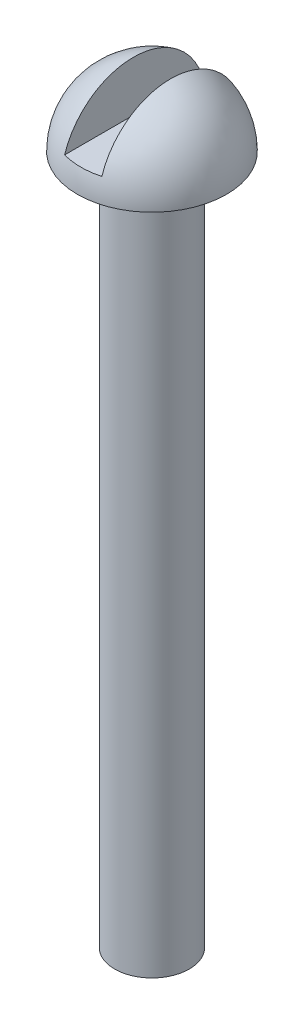
from build123d import *

# Parameters (mm, degrees)
SKETCH1_R               = 2
BOSS_EXTRUDE1_DEPTH     = 37
CUT_EXTRUDE1_DEPTH      = 42.388404173
CUT_EXTRUDE1_DEPTH_BACK = 42.388404173
SKETCH3_W               = 2
SKETCH3_H               = 3.126637596


with BuildPart() as part:
    # Sketch1 → Boss-Extrude1 (new body)
    with BuildSketch(Plane(origin=(0, 0, 0), x_dir=(1, 0, 0), z_dir=(0, 1, 0))):
        with Locations(Location((0, 0, 0), (0, 0, 270))):
            Circle(SKETCH1_R)
    extrude(amount=BOSS_EXTRUDE1_DEPTH)

    # Sketch2 → Revolve1 (revolve)
    with BuildSketch(Plane.XY):
        with BuildLine():
            Line((0, 41), (0, 37))
            Line((0, 37), (4, 37))
            ThreePointArc((4, 37), (2.828427125, 39.828427125), (0, 41))
        make_face()
    revolve(axis=Axis((0, 37, 0), (0, -1, 0)))

    # Sketch3 → Cut-Extrude1 (cut, two sides: drawn at the far end of the back side and taken through both)
    with BuildSketch(Plane.XY.offset(-CUT_EXTRUDE1_DEPTH_BACK)):
        with Locations((0, 39.743318798)):
            Rectangle(SKETCH3_W, SKETCH3_H)
    extrude(amount=CUT_EXTRUDE1_DEPTH + CUT_EXTRUDE1_DEPTH_BACK, mode=Mode.SUBTRACT)


solid = part.part
